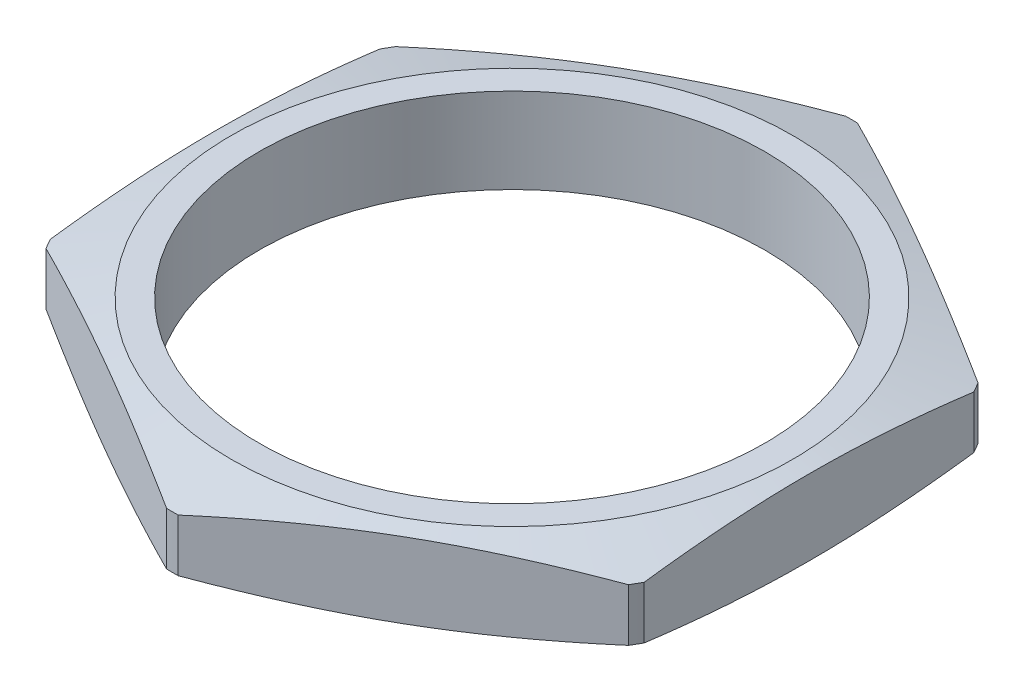
from build123d import *

# Parameters (mm, degrees)
SKETCH1_R           = 10.75
SKETCH1_R_2         = 8
BOSS_EXTRUDE1_DEPTH = 2.7
CHAMFER1_SIZE       = 0.5
CHAMFER1_SIZE2      = 1.866025404
CHAMFER2_SIZE       = 2
CHAMFER2_SIZE2      = 0.535898385
SKETCH3_OUTSIDE_W   = 29.606
SKETCH3_OUTSIDE_H   = 29.606
CUT_EXTRUDE1_DEPTH  = 2.7


with BuildPart() as part:
    # Sketch1 → Boss-Extrude1 (new body)
    with BuildSketch(Plane(origin=(0, 0, 0), x_dir=(1, 0, 0), z_dir=(0, 1, 0))):
        with Locations(Location((0, 0, 0), (0, 0, 90))):
            Circle(SKETCH1_R)
        with Locations(Location((0, 0, 0), (0, 0, 90))):
            Circle(SKETCH1_R_2, mode=Mode.SUBTRACT)
    extrude(amount=BOSS_EXTRUDE1_DEPTH)

    # Chamfer1
    chamfer1_edges = [part.edges().sort_by_distance(p)[0] for p in [
        (0, 2.7, 10.75),
    ]]
    chamfer1_side = [part.faces().sort_by_distance(p)[0] for p in [
        (0, 1.35, 10.75),
    ]]
    chamfer(chamfer1_edges, length=CHAMFER1_SIZE, length2=CHAMFER1_SIZE2, reference=chamfer1_side[0])

    # Chamfer2
    chamfer2_edges = [part.edges().sort_by_distance(p)[0] for p in [
        (0, 0, 10.75),
    ]]
    chamfer2_side = [part.faces().sort_by_distance(p)[0] for p in [
        (0, 0, 10.445944084),
    ]]
    chamfer(chamfer2_edges, length=CHAMFER2_SIZE, length2=CHAMFER2_SIZE2, reference=chamfer2_side[0])

    # Sketch3 outside → Cut-Extrude1 (cut)
    with BuildSketch(Plane(origin=(0, 2.7, 0), x_dir=(1, 0, 0), z_dir=(0, 1, 0))):
        Rectangle(SKETCH3_OUTSIDE_W, SKETCH3_OUTSIDE_H)
        Polygon((0, 10.854185061), (-9.4, 5.42709253), (-9.4, -5.42709253), (0, -10.854185061), (9.4, -5.42709253), (9.4, 5.42709253), align=None, mode=Mode.SUBTRACT)
    extrude(amount=-CUT_EXTRUDE1_DEPTH, mode=Mode.SUBTRACT)


solid = part.part
